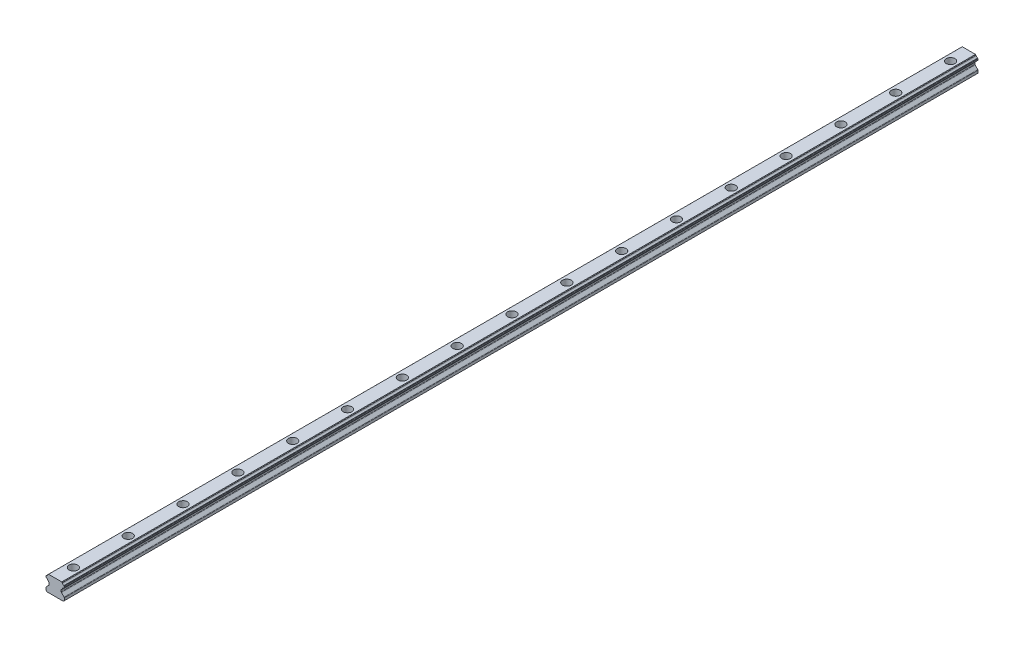
from build123d import *

# Parameters (mm, degrees)
BODY_DEPTH                     = 500
CBORE_FOR_M6_SHCS1_D           = 6
CBORE_FOR_M6_SHCS1_CBORE_D     = 9.5
CBORE_FOR_M6_SHCS1_CBORE_DEPTH = 8.4
LP_CBORE_COUNT                 = 17
LP_CBORE_PITCH                 = 60


with BuildPart() as part:
    # Sketch10 → BODY (new, symmetric)
    with BuildSketch(Plane.XY):
        with BuildLine():
            Line((-10, -10.338492954), (-10, -13))
            Line((-10, -13), (-9, -14))
            Line((-9, -14), (9, -14))
            Line((9, -14), (10, -13))
            Line((10, -13), (10, -10.338492954))
            ThreePointArc((10, -10.338492954), (9.92387953, -9.955809511), (9.707106773, -9.631386153))
            Line((9.707106773, -9.631386153), (6.892893227, -6.817172607))
            ThreePointArc((6.892893227, -6.817172607), (6.67612047, -6.492749249), (6.6, -6.110065806))
            Line((6.6, -6.110065806), (6.6, -4.549934184))
            ThreePointArc((6.6, -4.549934184), (6.67612047, -4.167250741), (6.892893227, -3.842827383))
            Line((6.892893227, -3.842827383), (7.63016236, -3.10555825))
            ThreePointArc((7.63016236, -3.10555825), (7.773916138, -2.959214094), (7.846806387, -2.767462244))
            ThreePointArc((7.846806387, -2.767462244), (8.396388302, -1.732072251), (9.431778289, -1.182490324))
            ThreePointArc((9.431778289, -1.182490324), (9.571491852, -1.133183296), (9.69062239, -1.045098237))
            Line((9.69062239, -1.045098237), (9.85355341, -0.8821672))
            ThreePointArc((9.85355341, -0.8821672), (9.961939771, -0.719955532), (10, -0.528613829))
            Line((10, -0.528613829), (10, 0.528613829))
            ThreePointArc((10, 0.528613829), (9.961939771, 0.719955532), (9.85355341, 0.8821672))
            Line((9.85355341, 0.8821672), (9.69062239, 1.045098237))
            ThreePointArc((9.69062239, 1.045098237), (9.568212026, 1.140675286), (9.422379794, 1.194081559))
            ThreePointArc((9.422379794, 1.194081559), (8.396063845, 1.741777544), (7.848162084, 2.767983654))
            ThreePointArc((7.848162084, 2.767983654), (7.775191194, 2.958001328), (7.63253117, 3.10318943))
            Line((7.63253117, 3.10318943), (7.2357206, 3.5))
            Line((7.2357206, 3.5), (-7.2357206, 3.5))
            Line((-7.2357206, 3.5), (-7.63253117, 3.10318943))
            ThreePointArc((-7.63253117, 3.10318943), (-7.775191194, 2.958001328), (-7.848162084, 2.767983654))
            ThreePointArc((-7.848162084, 2.767983654), (-8.396063845, 1.741777544), (-9.422379794, 1.194081559))
            ThreePointArc((-9.422379794, 1.194081559), (-9.568212026, 1.140675286), (-9.69062239, 1.045098237))
            Line((-9.69062239, 1.045098237), (-9.85355341, 0.8821672))
            ThreePointArc((-9.85355341, 0.8821672), (-9.961939771, 0.719955532), (-10, 0.528613829))
            Line((-10, 0.528613829), (-10, -0.528613829))
            ThreePointArc((-10, -0.528613829), (-9.961939771, -0.719955532), (-9.85355341, -0.8821672))
            Line((-9.85355341, -0.8821672), (-9.69062239, -1.045098237))
            ThreePointArc((-9.69062239, -1.045098237), (-9.571491852, -1.133183296), (-9.431778289, -1.182490324))
            ThreePointArc((-9.431778289, -1.182490324), (-8.396388302, -1.732072251), (-7.846806387, -2.767462244))
            ThreePointArc((-7.846806387, -2.767462244), (-7.773916138, -2.959214094), (-7.63016236, -3.10555825))
            Line((-7.63016236, -3.10555825), (-6.892893227, -3.842827383))
            ThreePointArc((-6.892893227, -3.842827383), (-6.67612047, -4.167250741), (-6.6, -4.549934184))
            Line((-6.6, -4.549934184), (-6.6, -6.110065806))
            ThreePointArc((-6.6, -6.110065806), (-6.67612047, -6.492749249), (-6.892893227, -6.817172607))
            Line((-6.892893227, -6.817172607), (-9.707106773, -9.631386153))
            ThreePointArc((-9.707106773, -9.631386153), (-9.92387953, -9.955809511), (-10, -10.338492954))
        make_face()
    extrude(amount=BODY_DEPTH, both=True)

    # CBORE for M6 SHCS1 (through all)
    with Locations(Plane(origin=(0, 3.5, 0), x_dir=(1, 0, 0), z_dir=(0, 1, 0))):
        with Locations((0, -480)):
            cbore_for_m6_shcs1 = CounterBoreHole(CBORE_FOR_M6_SHCS1_D / 2, CBORE_FOR_M6_SHCS1_CBORE_D / 2, CBORE_FOR_M6_SHCS1_CBORE_DEPTH)

    # MIRROR FIRST COUNTERBORE: CBORE for M6 SHCS1 across plane
    add(cbore_for_m6_shcs1.mirror(Plane.XY), mode=Mode.SUBTRACT)

    # LP CBORE: CBORE for M6 SHCS1 ×17
    with Locations(*[(0, 0, -i * LP_CBORE_PITCH) for i in range(1, LP_CBORE_COUNT)]):
        add(cbore_for_m6_shcs1, mode=Mode.SUBTRACT)


solid = part.part
